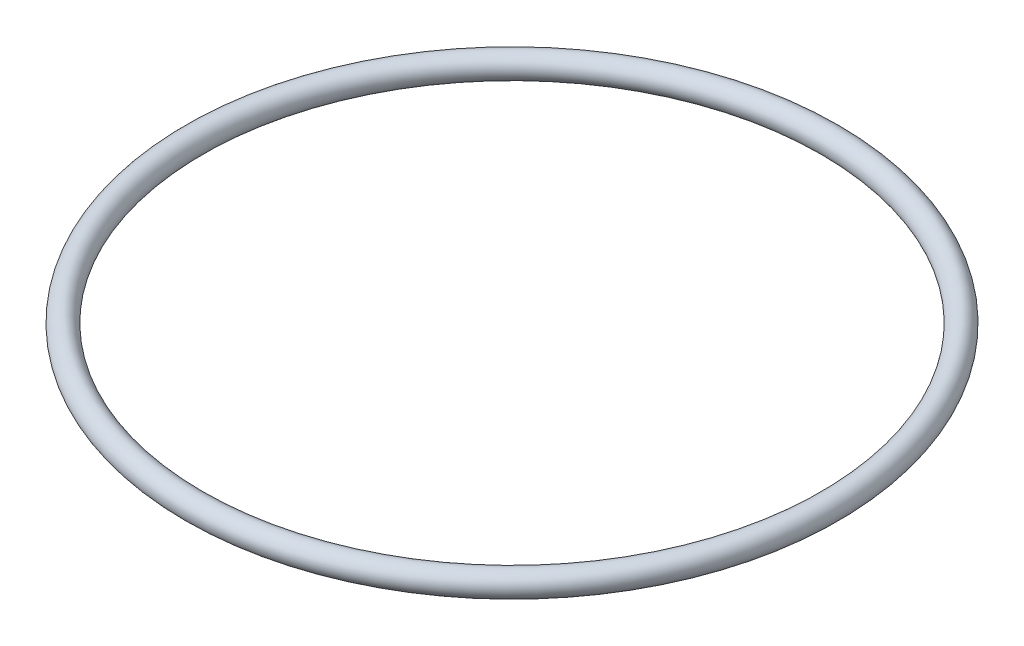
from build123d import *

# Parameters (mm, degrees)
CROQUIS1_R = 1.25


with BuildPart() as part:
    # Croquis1 → Revolución1 (revolve)
    with BuildSketch(Plane.XY, mode=Mode.PRIVATE) as revoluci_n1_sk:
        with Locations((33.15, 0)):
            Circle(CROQUIS1_R)
    revolve(revoluci_n1_sk.sketch.rotate(Axis((0, 0, 0), (0, 1, 0)), 90), axis=Axis((0, 0, 0), (0, 1, 0)))


solid = part.part
